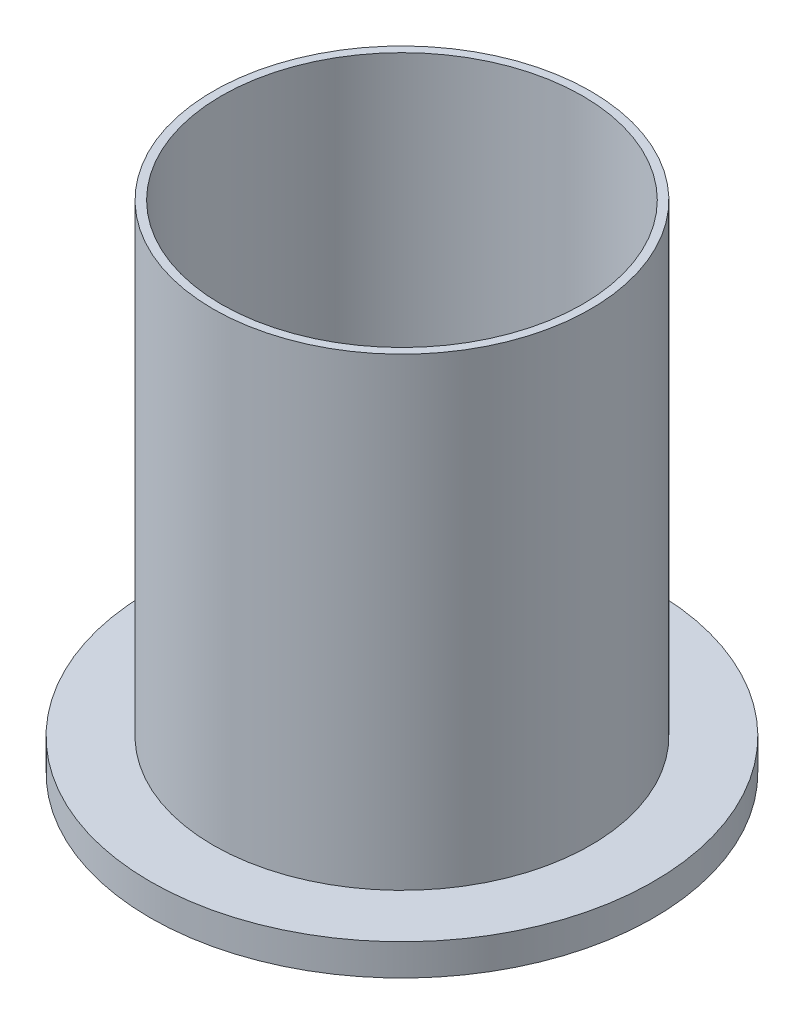
from build123d import *

# Parameters (mm, degrees)
SKETCH1_R           = 38.1
SKETCH1_R_2         = 36.449
BOSS_EXTRUDE1_DEPTH = 100.076
SKETCH1_3_R         = 50.8
SKETCH1_3_R_2       = 38.1
BOSS_EXTRUDE2_DEPTH = 6.35


with BuildPart() as part:
    # Sketch1 → Boss-Extrude1 (new body)
    with BuildSketch(Plane(origin=(0, 0, 0), x_dir=(1, 0, 0), z_dir=(0, 1, 0))):
        Circle(SKETCH1_R)
        Circle(SKETCH1_R_2, mode=Mode.SUBTRACT)
    extrude(amount=BOSS_EXTRUDE1_DEPTH)

    # Sketch1<3> → Boss-Extrude2 (add)
    with BuildSketch(Plane(origin=(0, 0, 0), x_dir=(1, 0, 0), z_dir=(0, 1, 0))):
        Circle(SKETCH1_3_R)
        Circle(SKETCH1_3_R_2, mode=Mode.SUBTRACT)
    extrude(amount=BOSS_EXTRUDE2_DEPTH)


solid = part.part
